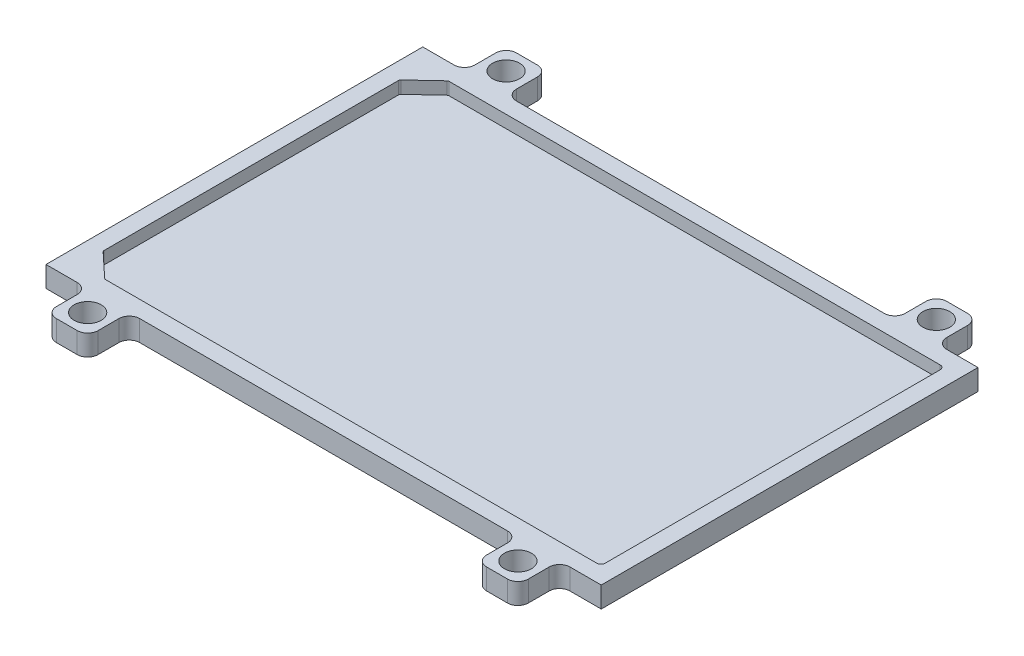
from build123d import *

# Parameters (mm, degrees)
SKETCH1_W           = 133.2946
SKETCH1_H           = 90.45
BOSS_EXTRUDE1_DEPTH = 5
SKETCH2_W           = 10
SKETCH2_H           = 10
BOSS_EXTRUDE2_DEPTH = 5
SKETCH4_R           = 3.25
CUT_EXTRUDE1_DEPTH  = 5
FILLET1_R           = 2.5
CUT_EXTRUDE2_DEPTH  = 3
FILLET2_R           = 1
FILLET3_R           = 0.5


with BuildPart() as part:
    # Sketch1 → Boss-Extrude1 (new body)
    with BuildSketch(Plane(origin=(0, 0, 0), x_dir=(1, 0, 0), z_dir=(0, 1, 0))):
        with Locations((-2.415435148, -78.733798602)):
            Rectangle(SKETCH1_W, SKETCH1_H)
    extrude(amount=BOSS_EXTRUDE1_DEPTH)

    # Sketch2 → Boss-Extrude2 (add)
    with BuildSketch(Plane(origin=(0, 5, 0), x_dir=(1, 0, 0), z_dir=(0, 1, 0))):
        with Locations((-54.062735148, -28.508798602)):
            Rectangle(SKETCH2_W, SKETCH2_H)
        with Locations((49.231864852, -28.508798602)):
            Rectangle(SKETCH2_W, SKETCH2_H)
        with Locations((49.231864852, -128.958798602)):
            Rectangle(SKETCH2_W, SKETCH2_H)
        with Locations((-54.062735148, -128.958798602)):
            Rectangle(SKETCH2_W, SKETCH2_H)
    extrude(amount=-BOSS_EXTRUDE2_DEPTH)

    # Sketch4 → Cut-Extrude1 (cut)
    with BuildSketch(Plane(origin=(0, 5, 0), x_dir=(1, 0, 0), z_dir=(0, 1, 0))):
        with Locations((49.231864852, -28.508798602)):
            Circle(SKETCH4_R)
        with Locations((-54.062735148, -28.508798602)):
            Circle(SKETCH4_R)
        with Locations((-54.062735148, -128.958798602)):
            Circle(SKETCH4_R)
        with Locations((49.231864852, -128.958798602)):
            Circle(SKETCH4_R)
    extrude(amount=-CUT_EXTRUDE1_DEPTH, mode=Mode.SUBTRACT)

    # Fillet1
    fillet1_edges = [part.edges().sort_by_distance(p)[0] for p in [
        (-59.062735148, 2.5, 33.508798602),
        (-59.062735148, 2.5, 23.508798602),
        (-49.062735148, 2.5, 23.508798602),
        (-49.062735148, 2.5, 33.508798602),
        (44.231864852, 2.5, 33.508798602),
        (44.231864852, 2.5, 23.508798602),
        (54.231864852, 2.5, 23.508798602),
        (54.231864852, 2.5, 33.508798602),
        (54.231864852, 2.5, 123.958798602),
        (54.231864852, 2.5, 133.958798602),
        (44.231864852, 2.5, 133.958798602),
        (44.231864852, 2.5, 123.958798602),
        (-49.062735148, 2.5, 123.958798602),
        (-49.062735148, 2.5, 133.958798602),
        (-59.062735148, 2.5, 133.958798602),
        (-59.062735148, 2.5, 123.958798602),
    ]]
    fillet(fillet1_edges, radius=FILLET1_R)

    # Sketch6 → Cut-Extrude2 (cut)
    with BuildSketch(Plane(origin=(0, 5, 0), x_dir=(1, 0, 0), z_dir=(0, 1, 0))):
        Polygon((-58.965485148, -119.958798602), (60.166814852, -119.958798602), (60.166814852, -37.508798602), (-58.965485148, -37.508798602), (-64.997685148, -43.148798602), (-64.997685148, -114.318798602), align=None)
    extrude(amount=-CUT_EXTRUDE2_DEPTH, mode=Mode.SUBTRACT)

    # Fillet2
    fillet2_edges = [part.edges().sort_by_distance(p)[0] for p in [
        (60.166814852, 3.5, 37.508798602),
        (60.166814852, 3.5, 119.958798602),
    ]]
    fillet(fillet2_edges, radius=FILLET2_R)

    # Fillet3
    fillet3_edges = [part.edges().sort_by_distance(p)[0] for p in [
        (-58.965485148, 3.5, 37.508798602),
        (-64.997685148, 3.5, 43.148798602),
        (-64.997685148, 3.5, 114.318798602),
        (-58.965485148, 3.5, 119.958798602),
    ]]
    fillet(fillet3_edges, radius=FILLET3_R)


solid = part.part
